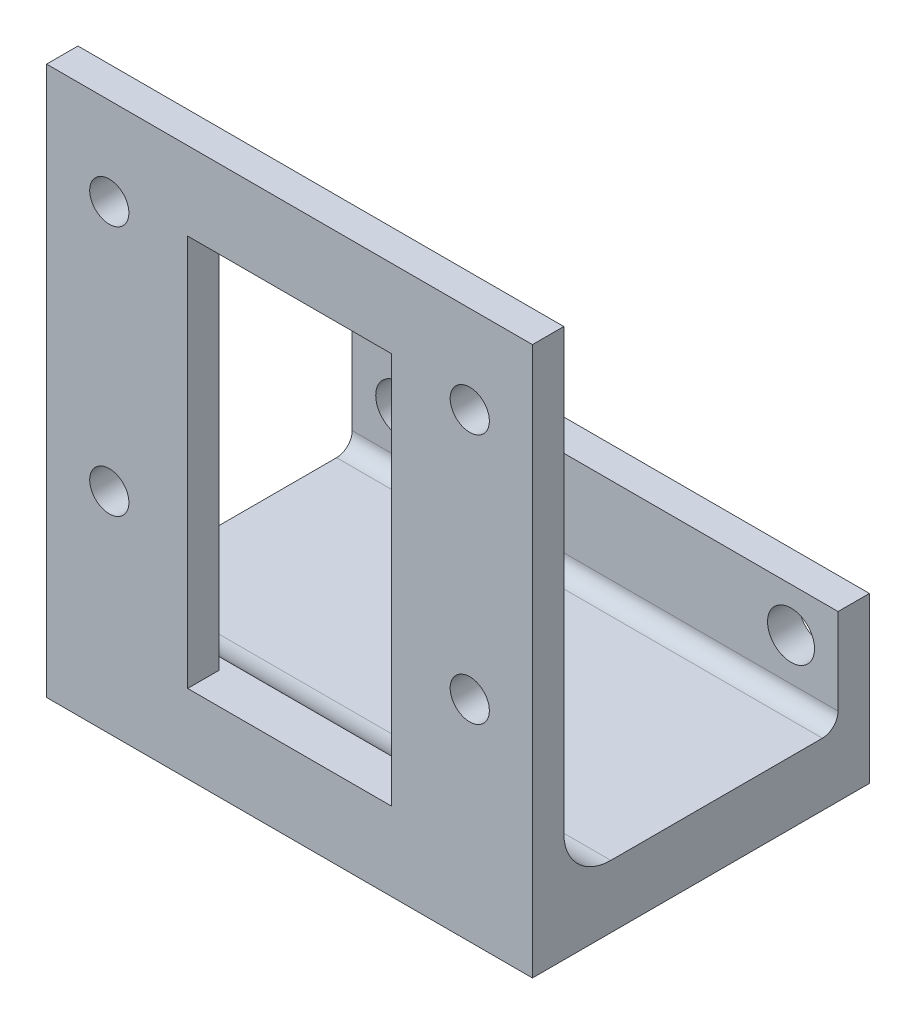
from build123d import *

# Parameters (mm, degrees)
SKETCH1_W           = 16
SKETCH1_H           = 4
BOSS_EXTRUDE1_DEPTH = 25
SKETCH2_W           = 16
SKETCH2_H           = 35
BOSS_EXTRUDE2_DEPTH = 2
FILLET1_R           = 3
SKETCH9_W           = 16
SKETCH9_H           = 5.5
CUT_EXTRUDE6_DEPTH  = 10
SKETCH10_W          = 16
SKETCH10_H          = 2
BOSS_EXTRUDE4_DEPTH = 8
SKETCH12_R          = 1.5
CUT_EXTRUDE7_DEPTH  = 10
SKETCH13_R          = 1
CUT_EXTRUDE8_DEPTH  = 10
BOSS_EXTRUDE5_START = 17
BOSS_EXTRUDE5_DEPTH = 17
SKETCH15_W          = 33
SKETCH15_H          = 1.5
CUT_EXTRUDE9_DEPTH  = 10
SKETCH17_W          = 7.5
SKETCH17_H          = 25
CUT_EXTRUDE11_DEPTH = 10
SKETCH18_R          = 1.1
CUT_EXTRUDE12_DEPTH = 27
SKETCH19_W          = 2
SKETCH19_H          = 35
CUT_EXTRUDE13_DEPTH = 27
SKETCH21_W          = 2
SKETCH21_H          = 25
BOSS_EXTRUDE6_DEPTH = 2
SKETCH22_R          = 1.5
CUT_EXTRUDE14_DEPTH = 11
FILLET2_R           = 1
SKETCH23_R          = 1.25
CUT_EXTRUDE15_DEPTH = 10


with BuildPart() as part:
    # Sketch1 → Boss-Extrude1 (new body)
    with BuildSketch(Plane.XY):
        Rectangle(SKETCH1_W, SKETCH1_H)
    extrude(amount=BOSS_EXTRUDE1_DEPTH)

    # Sketch2 → Boss-Extrude2 (add)
    with BuildSketch(Plane.XY.offset(25)):
        with Locations((0, 15.5)):
            Rectangle(SKETCH2_W, SKETCH2_H)
    extrude(amount=BOSS_EXTRUDE2_DEPTH)

    # Fillet1
    fillet1_edges = [part.edges().sort_by_distance(p)[0] for p in [
        (0, 2, 25),
    ]]
    fillet(fillet1_edges, radius=FILLET1_R)

    # Sketch9 → Cut-Extrude6 (cut)
    with BuildSketch(Plane(origin=(0, 2, 0), x_dir=(1, 0, 0), z_dir=(0, 1, 0))):
        with Locations((0, -2.75)):
            Rectangle(SKETCH9_W, SKETCH9_H)
    extrude(amount=-CUT_EXTRUDE6_DEPTH, mode=Mode.SUBTRACT)

    # Sketch10 → Boss-Extrude4 (add)
    with BuildSketch(Plane(origin=(0, 2, 0), x_dir=(1, 0, 0), z_dir=(0, 1, 0))):
        with Locations((0, -6.5)):
            Rectangle(SKETCH10_W, SKETCH10_H)
    extrude(amount=BOSS_EXTRUDE4_DEPTH)

    # Sketch12 → Cut-Extrude7 (cut)
    with BuildSketch(Plane.XY.offset(7.5)):
        with Locations((5, 5.69348198)):
            Circle(SKETCH12_R)
    extrude(amount=-CUT_EXTRUDE7_DEPTH, mode=Mode.SUBTRACT)

    # Sketch13 → Cut-Extrude8 (cut)
    with BuildSketch(Plane.XY.offset(27)):
        with Locations((4, 27.4)):
            Circle(SKETCH13_R)
        with Locations((4, 11.4)):
            Circle(SKETCH13_R)
    extrude(amount=-CUT_EXTRUDE8_DEPTH, mode=Mode.SUBTRACT)

    # Sketch14 → Boss-Extrude5 (add)
    with BuildSketch(Plane.ZY.offset(8).offset(BOSS_EXTRUDE5_START)):
        with BuildLine():
            Line((5.5, 10), (7.5, 10))
            Line((7.5, 10), (7.5, 2))
            Line((7.5, 2), (22, 2))
            ThreePointArc((22, 2), (24.121320344, 2.878679656), (25, 5))
            Line((25, 5), (25, 33))
            Line((25, 33), (27, 33))
            Line((27, 33), (27, -2))
            Line((27, -2), (5.5, -2))
            Line((5.5, -2), (5.5, 10))
        make_face()
    extrude(amount=-BOSS_EXTRUDE5_DEPTH)

    # Sketch15 → Cut-Extrude9 (cut)
    with BuildSketch(Plane(origin=(0, 0, 5.5), x_dir=(-1, 0, 0), z_dir=(0, 0, -1))):
        with Locations((8.5, 9.25)):
            Rectangle(SKETCH15_W, SKETCH15_H)
    extrude(amount=-CUT_EXTRUDE9_DEPTH, mode=Mode.SUBTRACT)

    # Sketch17 → Cut-Extrude11 (cut)
    with BuildSketch(Plane.XY.offset(27)):
        with Locations((-12.25, 15.5)):
            Rectangle(SKETCH17_W, SKETCH17_H)
        with Locations((-4.75, 15.5)):
            Rectangle(SKETCH17_W, SKETCH17_H)
    extrude(amount=-CUT_EXTRUDE11_DEPTH, mode=Mode.SUBTRACT)

    # Sketch18 → Cut-Extrude12 (cut)
    with BuildSketch(Plane(origin=(0, 0, 25), x_dir=(-1, 0, 0), z_dir=(0, 0, -1))):
        with Locations((19, 11.4)):
            Circle(SKETCH18_R)
        with Locations((19, 27.4)):
            Circle(SKETCH18_R)
        with Locations((-4, 27.4)):
            Circle(SKETCH18_R)
        with Locations((-4, 11.4)):
            Circle(SKETCH18_R)
    extrude(amount=-CUT_EXTRUDE12_DEPTH, mode=Mode.SUBTRACT)

    # Sketch19 → Cut-Extrude13 (cut)
    with BuildSketch(Plane(origin=(0, 0, 5.5), x_dir=(-1, 0, 0), z_dir=(0, 0, -1))):
        with Locations((24, 15.5)):
            Rectangle(SKETCH19_W, SKETCH19_H)
    extrude(amount=-CUT_EXTRUDE13_DEPTH, mode=Mode.SUBTRACT)

    # Sketch21 → Boss-Extrude6 (add)
    with BuildSketch(Plane.XY.offset(27)):
        with Locations((-15, 15.5)):
            Rectangle(SKETCH21_W, SKETCH21_H)
    extrude(amount=-BOSS_EXTRUDE6_DEPTH)

    # Sketch22 → Cut-Extrude14 (cut)
    with BuildSketch(Plane(origin=(0, 0, 5.5), x_dir=(-1, 0, 0), z_dir=(0, 0, -1))):
        with Locations((20, 5.69348198)):
            Circle(SKETCH22_R)
    extrude(amount=-CUT_EXTRUDE14_DEPTH, mode=Mode.SUBTRACT)

    # Fillet2
    fillet2_edges = [part.edges().sort_by_distance(p)[0] for p in [
        (-7.5, 2, 7.5),
    ]]
    fillet(fillet2_edges, radius=FILLET2_R)

    # Sketch23 → Cut-Extrude15 (cut)
    with BuildSketch(Plane.XY.offset(27)):
        with Locations((4, 27.4)):
            Circle(SKETCH23_R)
        with Locations((4, 11.4)):
            Circle(SKETCH23_R)
        with Locations((-19, 11.4)):
            Circle(SKETCH23_R)
        with Locations((-19, 27.4)):
            Circle(SKETCH23_R)
    extrude(amount=-CUT_EXTRUDE15_DEPTH, mode=Mode.SUBTRACT)


solid = part.part
